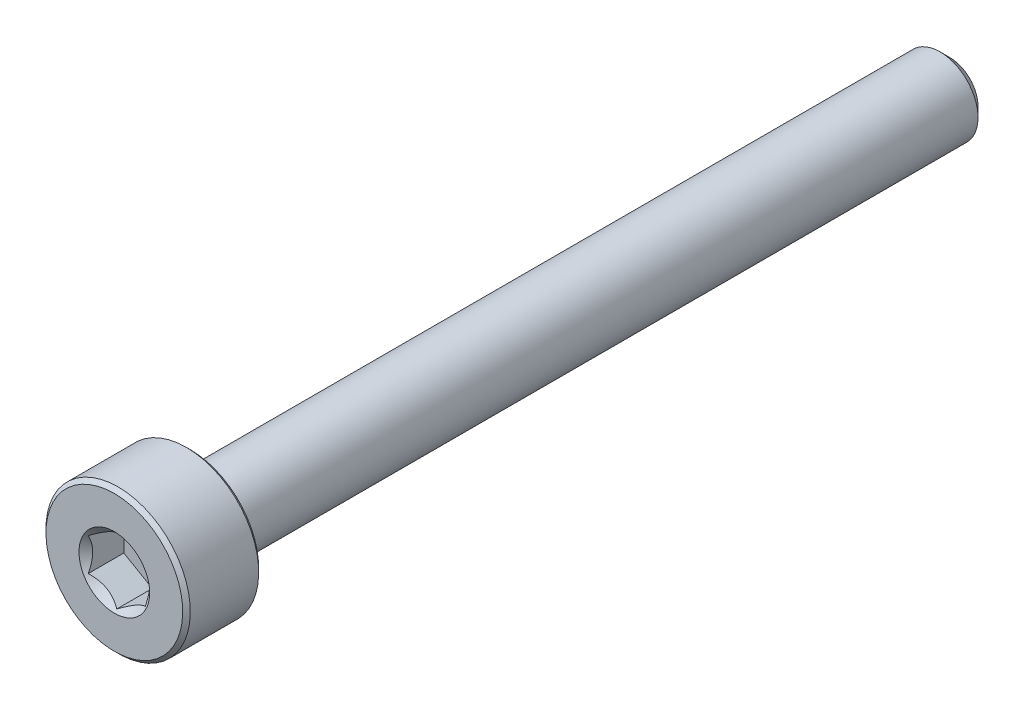
from build123d import *

# Parameters (mm, degrees)
CUT_EXTRUDE1_DEPTH = 1


with BuildPart() as part:
    # Sketch2 → Revolve1 (revolve)
    with BuildSketch(Plane(origin=(0, 0, 0), x_dir=(0, 0, -1), z_dir=(1, 0, 0))):
        with BuildLine():
            Line((-11, 0), (-11, 1.8))
            Line((-11, 1.8), (-10.9, 1.9))
            Line((-10.9, 1.9), (-9.1, 1.9))
            Line((-9.1, 1.9), (-9, 1.8))
            Line((-9, 1.8), (-9, 1.1))
            ThreePointArc((-9, 1.1), (-8.970710678, 1.029289322), (-8.9, 1))
            Line((-8.9, 1), (10.740192379, 1))
            Line((10.740192379, 1), (11, 0.740192379))
            Line((11, 0.740192379), (11, 0))
            Line((11, 0), (-11, 0))
        make_face()
    revolve(axis=Axis((0, 0, -11), (0, 0, 1)))

    # Sketch3 → Cut-Extrude1 (cut)
    with BuildSketch(Plane.XY.offset(11)):
        Polygon((0.75, -0.433012702), (0.75, 0.433012702), (0, 0.866025404), (-0.75, 0.433012702), (-0.75, -0.433012702), (0, -0.866025404), align=None)
    extrude(amount=-CUT_EXTRUDE1_DEPTH, mode=Mode.SUBTRACT)

    # Cut-Extrude2 cone 1 section (through the dimple's axis) → Cut-Extrude2 (revolve, cut)
    with BuildSketch(Plane(origin=(0, 0, 11), x_dir=(0, -1, 0), z_dir=(1, 0, 0))):
        Polygon((0, 0), (0.930977309, 0), (0, 0.930977309), align=None)
    revolve(axis=Axis((0, 0, 11), (0, 0, -1)), mode=Mode.SUBTRACT)


solid = part.part
